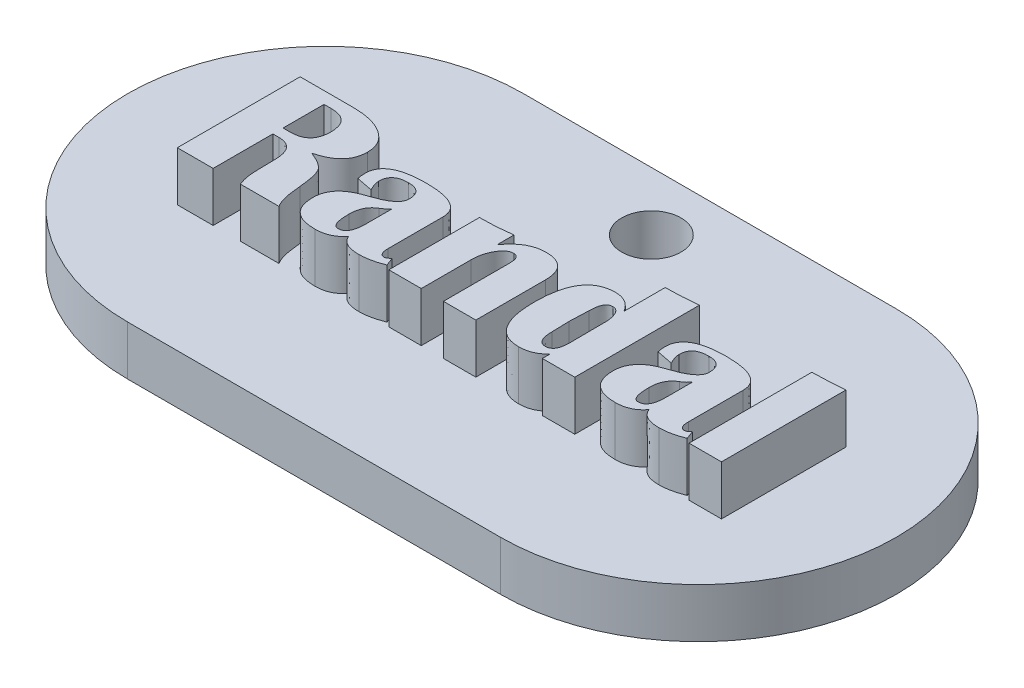
from build123d import *

# Parameters (mm, degrees)
BOSS_EXTRUDE1_DEPTH = 2.5
BOSS_EXTRUDE2_DEPTH = 2.5
SKETCH3_R           = 1.5
CUT_EXTRUDE1_DEPTH  = 5


with BuildPart() as part:
    # Sketch1 → Boss-Extrude1 (new body)
    with BuildSketch(Plane(origin=(0, 0, 0), x_dir=(1, 0, 0), z_dir=(0, 1, 0))):
        with BuildLine():
            Line((-9.422676429, 10), (9.422676429, 10))
            ThreePointArc((9.422676429, 10), (19.422676429, 0), (9.422676429, -10))
            Line((9.422676429, -10), (-9.422676429, -10))
            ThreePointArc((-9.422676429, -10), (-19.422676429, 0), (-9.422676429, 10))
        make_face()
    extrude(amount=BOSS_EXTRUDE1_DEPTH)

    # Sketch2 → Boss-Extrude2 (add)
    # profile 1 of 6: a face of its own
    with BuildSketch(Plane(origin=(0, 2.5, 0), x_dir=(1, 0, 0), z_dir=(0, 1, 0))):
        with BuildLine():
            Line((-13.300121133, -3.615227087), (-13.300121133, 2.59214596))
            Line((-13.300121133, 2.59214596), (-10.620766751, 2.59214596))
            add(Edge.make_bspline(
                [(-10.620766751, 2.59214596), (-10.534960365, 2.590926297), (-10.367589266, 2.588547264), (-10.122863574, 2.567894975), (-9.891520182, 2.534809914), (-9.672859265, 2.48808363), (-9.468362292, 2.425539623), (-9.27553326, 2.352419864), (-9.097683405, 2.262608118), (-8.932756774, 2.162392055), (-8.784834423, 2.049347534), (-8.654609226, 1.927382847), (-8.545338889, 1.794302207), (-8.454283855, 1.653447732), (-8.385227787, 1.501551715), (-8.33498572, 1.341534799), (-8.304579322, 1.171675538), (-8.301373014, 1.055246243), (-8.299737289, 0.995848855)],
                knots=[0, 0, 0, 0, 1.306972684, 2.549337699, 3.738257501, 4.865292255, 5.951610133, 6.993268715, 8.002784987, 8.982402698, 9.929155938, 10.833984252, 11.69405977, 12.546072884, 13.381671869, 14.227594668, 15.09579246, 16, 16, 16, 16], degree=3))
            add(Edge.make_bspline(
                [(-8.299737289, 0.995848855), (-8.300739959, 0.950447813), (-8.302712171, 0.861145812), (-8.319188654, 0.73039609), (-8.346022258, 0.605439961), (-8.384003641, 0.487028987), (-8.431019757, 0.37367222), (-8.490601917, 0.267284073), (-8.56098944, 0.167418499), (-8.64178427, 0.073257837), (-8.732568306, -0.015617309), (-8.836283557, -0.095929493), (-8.948746647, -0.172390976), (-9.072445692, -0.241670872), (-9.206452331, -0.305406835), (-9.351652008, -0.361739706), (-9.50732655, -0.412740649), (-9.615687033, -0.441573376), (-9.671071005, -0.456310031)],
                knots=[0, 0, 0, 0, 0.999139035, 1.96526581, 2.895900214, 3.808725844, 4.699118832, 5.592961802, 6.486968724, 7.384357296, 8.321061346, 9.278195975, 10.26790247, 11.312507066, 12.395774615, 13.532001202, 14.738584651, 16, 16, 16, 16], degree=3))
            add(Edge.make_bspline(
                [(-9.671071005, -0.456310031), (-9.616069374, -0.477316291), (-9.509993534, -0.517828848), (-9.360735182, -0.584978873), (-9.22730079, -0.654252333), (-9.106934527, -0.72189136), (-9.004042977, -0.795209803), (-8.914004739, -0.86715284), (-8.839933494, -0.941923355), (-8.779512374, -1.021572393), (-8.729796314, -1.111693637), (-8.685490826, -1.216484023), (-8.645845535, -1.339251995), (-8.609600689, -1.480074772), (-8.577828078, -1.638884969), (-8.54984592, -1.815521055), (-8.525522639, -2.010054758), (-8.513479475, -2.14595976), (-8.507188559, -2.216951648)],
                knots=[0, 0, 0, 0, 1.225899306, 2.364262592, 3.405591656, 4.356650469, 5.236059752, 6.033446588, 6.754175432, 7.421814961, 8.10843594, 8.891773243, 9.787730148, 10.792436378, 11.918404585, 13.158979899, 14.515953223, 16, 16, 16, 16], degree=3))
            add(Edge.make_bspline(
                [(-8.507188559, -2.216951648), (-8.499628511, -2.301418927), (-8.485166922, -2.462996091), (-8.456174044, -2.694154696), (-8.41925879, -2.902415081), (-8.380545694, -3.089186986), (-8.332635965, -3.252565737), (-8.282887195, -3.394860313), (-8.225802236, -3.515307342), (-8.178881039, -3.583396522), (-8.156946156, -3.615227087)],
                knots=[0, 0, 0, 0, 1.397178565, 2.672658018, 3.83661044, 4.881375567, 5.813226105, 6.639317975, 7.363903672, 8, 8, 8, 8], degree=3))
            Line((-8.156946156, -3.615227087), (-10.111568181, -3.615227087))
            add(Edge.make_bspline(
                [(-10.111568181, -3.615227087), (-10.14098398, -3.538616179), (-10.202114021, -3.379408266), (-10.256750447, -3.117501799), (-10.292400216, -2.830433405), (-10.296620116, -2.629735262), (-10.298813158, -2.525434379)],
                knots=[0, 0, 0, 0, 0.883751818, 1.83655679, 2.875679508, 4, 4, 4, 4], degree=3))
            Line((-10.298813158, -2.525434379), (-10.306895675, -2.152291512))
            Line((-10.306895675, -2.152291512), (-10.316325278, -1.683505527))
            add(Edge.make_bspline(
                [(-10.316325278, -1.683505527), (-10.317325906, -1.639494456), (-10.319257996, -1.554514423), (-10.327702855, -1.431037489), (-10.346224685, -1.316593856), (-10.367512744, -1.209691912), (-10.399711764, -1.112515815), (-10.435014503, -1.02227846), (-10.48041685, -0.941895471), (-10.52940234, -0.867579143), (-10.588542979, -0.804796888), (-10.651784902, -0.747795624), (-10.724675302, -0.702697644), (-10.802225324, -0.663223449), (-10.887268794, -0.632922867), (-10.978949403, -0.614247588), (-11.076951409, -0.599286105), (-11.144717996, -0.598276731), (-11.179807509, -0.597754078)],
                knots=[0, 0, 0, 0, 1.332825818, 2.573524801, 3.742441731, 4.840942882, 5.868429177, 6.837798795, 7.768658095, 8.658513287, 9.524477505, 10.372326923, 11.228310675, 12.10982003, 13.004128928, 13.950736595, 14.938892181, 16, 16, 16, 16], degree=3))
            Line((-11.179807509, -0.597754078), (-11.489637327, -0.597754078))
            Line((-11.489637327, -0.597754078), (-11.489637327, -3.615227087))
            Line((-11.489637327, -3.615227087), (-13.300121133, -3.615227087))
        make_face()
        with BuildLine():
            Line((-11.489637327, -0.080472991), (-11.125924063, -0.080472991))
            add(Edge.make_bspline(
                [(-11.125924063, -0.080472991), (-11.085033055, -0.079725447), (-11.005307858, -0.078267962), (-10.889956311, -0.066216034), (-10.78224427, -0.045981745), (-10.682470877, -0.017931419), (-10.590497115, 0.018020113), (-10.507119171, 0.063290464), (-10.431261586, 0.116177463), (-10.362080546, 0.176371118), (-10.302452063, 0.246200784), (-10.250792026, 0.323501302), (-10.208077329, 0.409384629), (-10.170889535, 0.502274099), (-10.145035894, 0.604373236), (-10.124482444, 0.71362389), (-10.112393209, 0.831236076), (-10.110959912, 0.91230223), (-10.110221095, 0.954089184)],
                knots=[0, 0, 0, 0, 1.179820008, 2.300295035, 3.342267738, 4.339024696, 5.287087512, 6.18577983, 7.070063511, 7.951399096, 8.824215462, 9.711910452, 10.627538894, 11.587657008, 12.593469482, 13.660914265, 14.794277731, 16, 16, 16, 16], degree=3))
            add(Edge.make_bspline(
                [(-10.110221095, 0.954089184), (-10.110959912, 0.995876138), (-10.112393209, 1.076942292), (-10.124482444, 1.194554478), (-10.145035894, 1.303805132), (-10.170889535, 1.405904269), (-10.208077329, 1.498793739), (-10.250792026, 1.584677066), (-10.302452063, 1.661977584), (-10.362080546, 1.73180725), (-10.431261586, 1.792000905), (-10.507119171, 1.844887904), (-10.590497115, 1.890158255), (-10.682470877, 1.926109786), (-10.78224427, 1.954160113), (-10.889956311, 1.974394402), (-11.005307858, 1.986446329), (-11.085033055, 1.987903815), (-11.125924063, 1.988651358)],
                knots=[0, 0, 0, 0, 1.205722269, 2.339085735, 3.406530518, 4.412342992, 5.372461106, 6.288089548, 7.175784538, 8.048600904, 8.929936489, 9.81422017, 10.712912488, 11.660975304, 12.657732262, 13.699704965, 14.820179992, 16, 16, 16, 16], degree=3))
            Line((-11.125924063, 1.988651358), (-11.489637327, 1.988651358))
            Line((-11.489637327, 1.988651358), (-11.489637327, -0.080472991))
        make_face(mode=Mode.SUBTRACT)
    # profile 2 of 6: a face of its own
    with BuildSketch(Plane(origin=(0, 2.5, 0), x_dir=(1, 0, 0), z_dir=(0, 1, 0))):
        with BuildLine():
            add(Edge.make_bspline(
                [(-2.866938787, -3.450882575), (-2.966431564, -3.48918748), (-3.160928015, -3.564068977), (-3.458424622, -3.641764447), (-3.751639019, -3.691553029), (-3.946661824, -3.698172536), (-4.042945009, -3.701440601)],
                knots=[0, 0, 0, 0, 1.056879314, 2.066072368, 3.0452157, 4, 4, 4, 4], degree=3))
            add(Edge.make_bspline(
                [(-4.042945009, -3.701440601), (-4.110391437, -3.700180587), (-4.238644044, -3.69778461), (-4.421260666, -3.672020586), (-4.583537281, -3.629829087), (-4.726504699, -3.570318771), (-4.849415149, -3.493677973), (-4.951202774, -3.398245333), (-5.034876576, -3.286777766), (-5.07030469, -3.200833225), (-5.088283873, -3.157217791)],
                knots=[0, 0, 0, 0, 1.282268188, 2.438294246, 3.499107553, 4.463668342, 5.373621945, 6.237846899, 7.105736429, 8, 8, 8, 8], degree=3))
            add(Edge.make_bspline(
                [(-5.088283873, -3.157217791), (-5.12316245, -3.200806031), (-5.191820312, -3.286608707), (-5.311948341, -3.398105032), (-5.443777225, -3.491327496), (-5.585926538, -3.568979762), (-5.74007482, -3.628310293), (-5.904928757, -3.671295905), (-6.081152022, -3.697391372), (-6.202233343, -3.700068511), (-6.264290094, -3.701440601)],
                knots=[0, 0, 0, 0, 0.993684051, 1.956049413, 2.908452201, 3.864343655, 4.834559242, 5.843680893, 6.89484061, 8, 8, 8, 8], degree=3))
            add(Edge.make_bspline(
                [(-6.264290094, -3.701440601), (-6.322261692, -3.700523204), (-6.434403287, -3.698748569), (-6.596805449, -3.681813467), (-6.748336262, -3.657083782), (-6.889058086, -3.620699292), (-7.018865854, -3.574009905), (-7.137209822, -3.515625848), (-7.243999188, -3.447030658), (-7.339572721, -3.367582544), (-7.425020867, -3.278798985), (-7.498406376, -3.178178894), (-7.558731644, -3.06611959), (-7.610249285, -2.945105481), (-7.649526266, -2.813157328), (-7.675174223, -2.670785647), (-7.693918693, -2.518292709), (-7.695452087, -2.412791115), (-7.696242688, -2.358395695)],
                knots=[0, 0, 0, 0, 1.235120868, 2.38924627, 3.476397774, 4.504669834, 5.482542067, 6.411274067, 7.311157636, 8.181131531, 9.05431034, 9.930995801, 10.82613438, 11.761058323, 12.729945035, 13.752859149, 14.841399769, 16, 16, 16, 16], degree=3))
            add(Edge.make_bspline(
                [(-7.696242688, -2.358395695), (-7.695130766, -2.316593976), (-7.692947642, -2.234521304), (-7.677987047, -2.113618304), (-7.652439077, -1.997201425), (-7.615895651, -1.885489443), (-7.570021793, -1.778561821), (-7.514241554, -1.676544528), (-7.44829897, -1.579221728), (-7.370503637, -1.487776457), (-7.284437849, -1.399458804), (-7.186386489, -1.317362375), (-7.078868467, -1.239389613), (-6.961274535, -1.166633486), (-6.83371805, -1.099142346), (-6.695990804, -1.036053235), (-6.548284407, -0.976524628), (-6.445006138, -0.942481431), (-6.39226328, -0.925096016)],
                knots=[0, 0, 0, 0, 0.958959357, 1.882801888, 2.790126755, 3.689285561, 4.575305972, 5.455859481, 6.353068664, 7.26715253, 8.206883801, 9.179032903, 10.19699077, 11.25186367, 12.348710126, 13.505688165, 14.726187642, 16, 16, 16, 16], degree=3))
            add(Edge.make_bspline(
                [(-6.39226328, -0.925096016), (-6.298447183, -0.893460213), (-6.121084357, -0.833651548), (-5.877142616, -0.731960669), (-5.669471605, -0.626248561), (-5.499732562, -0.513836161), (-5.366130506, -0.396178013), (-5.267822982, -0.274274512), (-5.207653159, -0.143005026), (-5.199872452, -0.052288158), (-5.196050766, -0.007730338)],
                knots=[0, 0, 0, 0, 1.488797015, 2.814626232, 3.971579162, 4.988716818, 5.868735512, 6.638787967, 7.331407237, 8, 8, 8, 8], degree=3))
            add(Edge.make_bspline(
                [(-5.196050766, -0.007730338), (-5.19775117, 0.047237267), (-5.200966254, 0.151168763), (-5.234569904, 0.296898874), (-5.291617942, 0.421036023), (-5.371272944, 0.524946126), (-5.476919711, 0.602577761), (-5.604161984, 0.656761844), (-5.752450589, 0.690631538), (-5.859067575, 0.693783445), (-5.915394778, 0.69544864)],
                knots=[0, 0, 0, 0, 1.142637826, 2.160473586, 3.088677903, 3.967383079, 4.855235242, 5.784239067, 6.829383386, 8, 8, 8, 8], degree=3))
            add(Edge.make_bspline(
                [(-5.915394778, 0.69544864), (-5.9806657, 0.693708095), (-6.103145399, 0.690441993), (-6.274542971, 0.658046783), (-6.420578751, 0.605643163), (-6.541560515, 0.529674836), (-6.636037782, 0.43048713), (-6.701175832, 0.307868241), (-6.741264234, 0.164919148), (-6.74559889, 0.062607331), (-6.747894028, 0.008434696)],
                knots=[0, 0, 0, 0, 1.268973575, 2.381205858, 3.379395825, 4.271425461, 5.136821322, 6.012741233, 6.947775072, 8, 8, 8, 8], degree=3))
            add(Edge.make_bspline(
                [(-6.747894028, 0.008434696), (-6.744966427, -0.030351878), (-6.738581766, -0.114939624), (-6.702136145, -0.249369939), (-6.643053619, -0.400124948), (-6.59201419, -0.504277666), (-6.564690309, -0.560035665)],
                knots=[0, 0, 0, 0, 0.774171244, 1.688352274, 2.762462888, 4, 4, 4, 4], degree=3))
            Line((-6.564690309, -0.560035665), (-7.387759956, -0.401079498))
            add(Edge.make_bspline(
                [(-7.387759956, -0.401079498), (-7.402463452, -0.330836352), (-7.430745443, -0.195724545), (-7.435378002, -0.057789454), (-7.437602144, 0.008434696)],
                knots=[0, 0, 0, 0, 1.039778055, 2, 2, 2, 2], degree=3))
            add(Edge.make_bspline(
                [(-7.437602144, 0.008434696), (-7.436012011, 0.053877803), (-7.432920593, 0.142224941), (-7.410032969, 0.270244607), (-7.370288931, 0.388764237), (-7.316131721, 0.499339453), (-7.245458946, 0.601180031), (-7.158305715, 0.693285075), (-7.055397918, 0.775418153), (-6.939631416, 0.852000455), (-6.805733108, 0.915811989), (-6.657368131, 0.972002009), (-6.493613956, 1.020829851), (-6.314163368, 1.058762575), (-6.119572867, 1.090234001), (-5.909450668, 1.110599868), (-5.683892728, 1.124834397), (-5.528356896, 1.125943095), (-5.447955879, 1.126516213)],
                knots=[0, 0, 0, 0, 0.851624305, 1.655665189, 2.427562795, 3.187947522, 3.956118909, 4.74211419, 5.555833429, 6.419641229, 7.338145349, 8.329219093, 9.391807277, 10.537582445, 11.765005819, 13.084959286, 14.493130256, 16, 16, 16, 16], degree=3))
            add(Edge.make_bspline(
                [(-5.447955879, 1.126516213), (-5.371610098, 1.125739147), (-5.223755392, 1.124234246), (-5.009236133, 1.112735712), (-4.809852042, 1.090408227), (-4.624609139, 1.063658987), (-4.454911542, 1.025087824), (-4.298911562, 0.981921953), (-4.158438804, 0.927734032), (-4.0321889, 0.866159183), (-3.920851886, 0.795413784), (-3.822422582, 0.717988054), (-3.741435733, 0.629334897), (-3.674028461, 0.533560942), (-3.621042619, 0.429893801), (-3.585024071, 0.316983392), (-3.560849494, 0.196713413), (-3.55896115, 0.113182849), (-3.55799399, 0.07040066)],
                knots=[0, 0, 0, 0, 1.50926466, 2.922910493, 4.244308801, 5.474613126, 6.620353895, 7.682365775, 8.671464678, 9.592456737, 10.454360259, 11.275054007, 12.060273444, 12.818746299, 13.584919584, 14.351247116, 15.155551521, 16, 16, 16, 16], degree=3))
            Line((-3.55799399, 0.07040066), (-3.55799399, -2.704596839))
            add(Edge.make_bspline(
                [(-3.55799399, -2.704596839), (-3.557455894, -2.74192292), (-3.556440424, -2.81236293), (-3.542895433, -2.91029534), (-3.522578979, -2.994372051), (-3.491169641, -3.062377234), (-3.453474563, -3.118255482), (-3.40349262, -3.157094332), (-3.34417698, -3.179363986), (-3.302235558, -3.182522318), (-3.28049424, -3.184159514)],
                knots=[0, 0, 0, 0, 1.438880701, 2.715387445, 3.807936607, 4.761419332, 5.593180532, 6.383303817, 7.161947702, 8, 8, 8, 8], degree=3))
            add(Edge.make_bspline(
                [(-3.28049424, -3.184159514), (-3.264058523, -3.18187803), (-3.226176858, -3.176619578), (-3.1682678, -3.143856689), (-3.098621839, -3.098246146), (-3.05187622, -3.057358402), (-3.025894955, -3.03463295)],
                knots=[0, 0, 0, 0, 0.659262562, 1.519493412, 2.621331725, 4, 4, 4, 4], degree=3))
            Line((-3.025894955, -3.03463295), (-2.866938787, -3.450882575))
        make_face()
        with BuildLine():
            add(Edge.make_bspline(
                [(-5.196050766, -0.868518397), (-5.248674911, -0.925867584), (-5.353847129, -1.040483056), (-5.484870251, -1.124330861), (-5.550334427, -1.166224439)],
                knots=[0, 0, 0, 0, 1.000723297, 2, 2, 2, 2], degree=3))
            add(Edge.make_bspline(
                [(-5.550334427, -1.166224439), (-5.590619754, -1.192570062), (-5.67005709, -1.244520146), (-5.774895158, -1.339975347), (-5.862996114, -1.448743525), (-5.935781153, -1.570512169), (-5.990281819, -1.705724639), (-6.029172904, -1.853283871), (-6.054068944, -2.013152), (-6.05678153, -2.12435467), (-6.058185911, -2.181927407)],
                knots=[0, 0, 0, 0, 0.967677045, 1.908131107, 2.839684773, 3.775830093, 4.752580097, 5.763193974, 6.841942867, 8, 8, 8, 8], degree=3))
            add(Edge.make_bspline(
                [(-6.058185911, -2.181927407), (-6.057230128, -2.253342917), (-6.055441931, -2.386955919), (-6.040589975, -2.573649772), (-6.012231551, -2.73172545), (-5.977131624, -2.863021817), (-5.927171979, -2.965217031), (-5.867564487, -3.0414579), (-5.791926936, -3.089426088), (-5.735948925, -3.095104919), (-5.707943508, -3.097945999)],
                knots=[0, 0, 0, 0, 1.606661438, 3.005941722, 4.206714796, 5.21687408, 6.052624467, 6.748462188, 7.373864194, 8, 8, 8, 8], degree=3))
            add(Edge.make_bspline(
                [(-5.707943508, -3.097945999), (-5.667508915, -3.095328124), (-5.589476978, -3.090276067), (-5.481115677, -3.044130147), (-5.388683484, -2.970374536), (-5.317587597, -2.864290489), (-5.26080859, -2.732986055), (-5.224009308, -2.572416062), (-5.199730434, -2.384738567), (-5.197330477, -2.249825093), (-5.196050766, -2.177886149)],
                knots=[0, 0, 0, 0, 0.819770896, 1.582019392, 2.355801278, 3.195313958, 4.153195118, 5.255097872, 6.536355541, 8, 8, 8, 8], degree=3))
            Line((-5.196050766, -2.177886149), (-5.196050766, -0.868518397))
        make_face(mode=Mode.SUBTRACT)
    # profile 3 of 6: a face of its own
    with BuildSketch(Plane(origin=(0, 2.5, 0), x_dir=(1, 0, 0), z_dir=(0, 1, 0))):
        with BuildLine():
            Line((1.787243912, -3.615227087), (0.149187136, -3.615227087))
            Line((0.149187136, -3.615227087), (0.149187136, -0.25963545))
            add(Edge.make_bspline(
                [(0.149187136, -0.25963545), (0.14819771, -0.218723212), (0.146341883, -0.141985699), (0.131761177, -0.034839232), (0.108434275, 0.056726426), (0.074246206, 0.132953662), (0.026716724, 0.190872247), (-0.028250255, 0.235486006), (-0.096336301, 0.260322866), (-0.144735369, 0.262986602), (-0.170072285, 0.264381068)],
                knots=[0, 0, 0, 0, 1.419672355, 2.66282487, 3.744098251, 4.692270244, 5.534477553, 6.323214835, 7.122202843, 8, 8, 8, 8], degree=3))
            add(Edge.make_bspline(
                [(-0.170072285, 0.264381068), (-0.196674124, 0.262998916), (-0.249645367, 0.260246689), (-0.328019611, 0.240502045), (-0.403336146, 0.207998583), (-0.476022671, 0.162622469), (-0.54461652, 0.103832606), (-0.611093997, 0.032666891), (-0.675465808, -0.050549818), (-0.7564645, -0.17971327), (-0.842506766, -0.3591411), (-0.919039895, -0.593450415), (-0.963514916, -0.847076269), (-0.968849884, -1.022360183), (-0.971588553, -1.112340993)],
                knots=[0, 0, 0, 0, 0.55096084, 1.097107635, 1.664023695, 2.244969598, 2.86568823, 3.530521354, 4.260116113, 5.042286902, 6.686134913, 8.369279496, 10.136194235, 12, 12, 12, 12], degree=3))
            Line((-0.971588553, -1.112340993), (-0.971588553, -3.615227087))
            Line((-0.971588553, -3.615227087), (-2.60964533, -3.615227087))
            Line((-2.60964533, -3.615227087), (-2.60964533, 0.963518787))
            add(Edge.make_bspline(
                [(-2.60964533, 0.963518787), (-2.46996781, 0.964686188), (-2.192688432, 0.96700364), (-1.779771805, 0.98945725), (-1.373082069, 1.025032337), (-1.104839653, 1.060434744), (-0.971588553, 1.078021111)],
                knots=[0, 0, 0, 0, 1.019838513, 2.024521838, 3.01866886, 4, 4, 4, 4], degree=3))
            Line((-0.971588553, 1.078021111), (-0.971588553, 0.219927224))
            add(Edge.make_bspline(
                [(-0.971588553, 0.219927224), (-0.918343646, 0.292137854), (-0.815100218, 0.43215637), (-0.639078671, 0.615746803), (-0.457167836, 0.774099076), (-0.265145629, 0.903333884), (-0.063229519, 1.002594985), (0.146499284, 1.074942234), (0.366150428, 1.117587232), (0.515411953, 1.123513715), (0.591031398, 1.126516213)],
                knots=[0, 0, 0, 0, 1.143084199, 2.216473584, 3.235708746, 4.214036931, 5.159017111, 6.097049134, 7.035919746, 8, 8, 8, 8], degree=3))
            add(Edge.make_bspline(
                [(0.591031398, 1.126516213), (0.639550745, 1.125301554), (0.733188548, 1.122957377), (0.869398741, 1.110059289), (0.995979757, 1.085655527), (1.113513633, 1.05259134), (1.221261187, 1.008819952), (1.320082398, 0.956549419), (1.409620716, 0.894124577), (1.490327676, 0.822255383), (1.559844886, 0.739461633), (1.621877333, 0.648296964), (1.671863338, 0.546586927), (1.71636077, 0.436833364), (1.747772563, 0.316266097), (1.770024965, 0.186440385), (1.785879437, 0.047436136), (1.786780016, -0.048544607), (1.787243912, -0.097985111)],
                knots=[0, 0, 0, 0, 1.18608447, 2.289032083, 3.339401178, 4.332842404, 5.268273941, 6.17659521, 7.059499146, 7.929900425, 8.809592672, 9.695356774, 10.61808369, 11.573894616, 12.585536979, 13.655503672, 14.792329834, 16, 16, 16, 16], degree=3))
            Line((1.787243912, -0.097985111), (1.787243912, -3.615227087))
        make_face()
    # profile 4 of 6: a face of its own
    with BuildSketch(Plane(origin=(0, 2.5, 0), x_dir=(1, 0, 0), z_dir=(0, 1, 0))):
        with BuildLine():
            Line((6.787627755, 2.687789078), (6.787627755, -3.615227087))
            Line((6.787627755, -3.615227087), (5.149570979, -3.615227087))
            Line((5.149570979, -3.615227087), (5.149570979, -3.22053084))
            add(Edge.make_bspline(
                [(5.149570979, -3.22053084), (5.114154566, -3.259251843), (5.044229378, -3.335701519), (4.923502847, -3.432061018), (4.797038532, -3.517254231), (4.659741439, -3.584201105), (4.514431011, -3.637261083), (4.36002033, -3.675165592), (4.196418636, -3.696271931), (4.084533222, -3.699694416), (4.027448204, -3.701440601)],
                knots=[0, 0, 0, 0, 0.997189238, 1.968822863, 2.931091854, 3.894157346, 4.867367995, 5.870507821, 6.913512539, 8, 8, 8, 8], degree=3))
            add(Edge.make_bspline(
                [(4.027448204, -3.701440601), (3.964919312, -3.699736344), (3.842783467, -3.696407468), (3.666085918, -3.667455017), (3.500899708, -3.621661646), (3.347277308, -3.557615401), (3.208170117, -3.470994608), (3.079177851, -3.368956762), (2.962954348, -3.24712729), (2.86103955, -3.105054156), (2.768237673, -2.946984977), (2.691292886, -2.7685654), (2.623132951, -2.573053106), (2.571053815, -2.357991334), (2.526747069, -2.12529428), (2.499222166, -1.873504223), (2.478922878, -1.603461792), (2.477623138, -1.417275208), (2.476952028, -1.321139348)],
                knots=[0, 0, 0, 0, 0.932392274, 1.821214413, 2.663232004, 3.485727835, 4.294605472, 5.100230628, 5.93418763, 6.797132845, 7.703728438, 8.663516709, 9.691056554, 10.789446544, 11.961510558, 13.222932412, 14.566084756, 16, 16, 16, 16], degree=3))
            add(Edge.make_bspline(
                [(2.476952028, -1.321139348), (2.478308879, -1.222327085), (2.480938837, -1.030801129), (2.499286024, -0.75326027), (2.531927685, -0.49476359), (2.575024546, -0.254987902), (2.63331178, -0.034493327), (2.70263562, 0.167445824), (2.786151833, 0.350442882), (2.882974133, 0.514167627), (2.992777448, 0.658540549), (3.115392411, 0.783806294), (3.249983677, 0.891839435), (3.400617739, 0.976292007), (3.561748386, 1.044420183), (3.735897828, 1.093090267), (3.923234586, 1.121438276), (4.052494007, 1.124790264), (4.119050063, 1.126516213)],
                knots=[0, 0, 0, 0, 1.41862167, 2.749687786, 3.990673848, 5.157724951, 6.244472151, 7.261833063, 8.219518982, 9.1272107, 9.987224015, 10.816911206, 11.638469072, 12.455665011, 13.287778011, 14.14495974, 15.044834311, 16, 16, 16, 16], degree=3))
            add(Edge.make_bspline(
                [(4.119050063, 1.126516213), (4.171704009, 1.124741412), (4.275107077, 1.121256015), (4.426358228, 1.092622906), (4.568482711, 1.043075675), (4.703743201, 0.977514479), (4.828379677, 0.888923061), (4.946587988, 0.78376725), (5.054348837, 0.657283733), (5.117280704, 0.563208828), (5.149570979, 0.514939094)],
                knots=[0, 0, 0, 0, 1.00554, 1.974703311, 2.926974345, 3.874635558, 4.836098201, 5.838522626, 6.890948257, 8, 8, 8, 8], degree=3))
            Line((5.149570979, 0.514939094), (5.149570979, 2.59214596))
            add(Edge.make_bspline(
                [(5.149570979, 2.59214596), (5.276222685, 2.593006628), (5.53639757, 2.59477466), (5.936084956, 2.61570983), (6.355694257, 2.644314537), (6.641312625, 2.673062313), (6.787627755, 2.687789078)],
                knots=[0, 0, 0, 0, 0.925741002, 1.901707974, 2.925097596, 4, 4, 4, 4], degree=3))
        make_face()
        with BuildLine():
            add(Edge.make_bspline(
                [(4.659231615, 0.436808097), (4.625980534, 0.434890828), (4.561562736, 0.431176476), (4.473303706, 0.389917352), (4.39728679, 0.32760599), (4.339475088, 0.236537216), (4.294987552, 0.123488497), (4.261178913, -0.01321748), (4.24408983, -0.17433724), (4.241610707, -0.289685907), (4.240287818, -0.35123731)],
                knots=[0, 0, 0, 0, 0.795622095, 1.541370116, 2.301723756, 3.13575848, 4.105980722, 5.220975086, 6.517079688, 8, 8, 8, 8], degree=3))
            Line((4.240287818, -0.35123731), (4.201222319, -1.321139348))
            Line((4.201222319, -1.321139348), (4.226816956, -2.204827872))
            add(Edge.make_bspline(
                [(4.226816956, -2.204827872), (4.227629648, -2.267794158), (4.22915693, -2.386125911), (4.252617425, -2.550795788), (4.28660603, -2.692037459), (4.339762587, -2.807411562), (4.405775501, -2.900077867), (4.489953416, -2.966577498), (4.590503361, -3.005762031), (4.662477016, -3.009699287), (4.6996442, -3.011732485)],
                knots=[0, 0, 0, 0, 1.435849857, 2.698374679, 3.789745713, 4.738976688, 5.581498506, 6.362685285, 7.154490948, 8, 8, 8, 8], degree=3))
            add(Edge.make_bspline(
                [(4.6996442, -3.011732485), (4.735972978, -3.009813296), (4.80590495, -3.006118907), (4.902897202, -2.965662455), (4.984923559, -2.901632924), (5.050871757, -2.811566179), (5.099396632, -2.69705791), (5.135330274, -2.559187102), (5.156030197, -2.396732061), (5.15796801, -2.280326138), (5.159000582, -2.218298734)],
                knots=[0, 0, 0, 0, 0.842588964, 1.621962277, 2.404981474, 3.242288514, 4.193401683, 5.287622157, 6.554697629, 8, 8, 8, 8], degree=3))
            Line((5.159000582, -2.218298734), (5.149570979, -1.10291139))
            Line((5.149570979, -1.10291139), (5.14552972, -0.341807707))
            add(Edge.make_bspline(
                [(5.14552972, -0.341807707), (5.139092537, -0.281008909), (5.12693896, -0.166219121), (5.091858415, -0.007505682), (5.048119976, 0.128150876), (4.99405918, 0.240231916), (4.927226195, 0.328333225), (4.8483909, 0.391505509), (4.757267964, 0.430431002), (4.69238641, 0.434651435), (4.659231615, 0.436808097)],
                knots=[0, 0, 0, 0, 1.452723371, 2.742781328, 3.856939202, 4.835756538, 5.687879974, 6.463239017, 7.214707542, 8, 8, 8, 8], degree=3))
        make_face(mode=Mode.SUBTRACT)
    # profile 5 of 6: a face of its own
    with BuildSketch(Plane(origin=(0, 2.5, 0), x_dir=(1, 0, 0), z_dir=(0, 1, 0))):
        with BuildLine():
            add(Edge.make_bspline(
                [(12.306639772, -3.450882575), (12.207146996, -3.48918748), (12.012650544, -3.564068977), (11.715153937, -3.641764447), (11.42193954, -3.691553029), (11.226916735, -3.698172536), (11.13063355, -3.701440601)],
                knots=[0, 0, 0, 0, 1.056879314, 2.066072368, 3.0452157, 4, 4, 4, 4], degree=3))
            add(Edge.make_bspline(
                [(11.13063355, -3.701440601), (11.063187122, -3.700180587), (10.934934515, -3.69778461), (10.752317893, -3.672020586), (10.590041278, -3.629829087), (10.44707386, -3.570318771), (10.32416341, -3.493677973), (10.222375785, -3.398245333), (10.138701983, -3.286777766), (10.103273869, -3.200833225), (10.085294686, -3.157217791)],
                knots=[0, 0, 0, 0, 1.282268188, 2.438294246, 3.499107553, 4.463668342, 5.373621945, 6.237846899, 7.105736429, 8, 8, 8, 8], degree=3))
            add(Edge.make_bspline(
                [(10.085294686, -3.157217791), (10.050416109, -3.200806031), (9.981758247, -3.286608707), (9.861630218, -3.398105032), (9.729801334, -3.491327496), (9.587652021, -3.568979762), (9.433503739, -3.628310293), (9.268649802, -3.671295905), (9.092426537, -3.697391372), (8.971345216, -3.700068511), (8.909288465, -3.701440601)],
                knots=[0, 0, 0, 0, 0.993684051, 1.956049413, 2.908452201, 3.864343655, 4.834559242, 5.843680893, 6.89484061, 8, 8, 8, 8], degree=3))
            add(Edge.make_bspline(
                [(8.909288465, -3.701440601), (8.851316867, -3.700523204), (8.739175272, -3.698748569), (8.57677311, -3.681813467), (8.425242297, -3.657083782), (8.284520473, -3.620699292), (8.154712705, -3.574009905), (8.036368737, -3.515625848), (7.929579371, -3.447030658), (7.834005838, -3.367582544), (7.748557692, -3.278798985), (7.675172183, -3.178178894), (7.614846915, -3.06611959), (7.563329274, -2.945105481), (7.524052293, -2.813157328), (7.498404336, -2.670785647), (7.479659866, -2.518292709), (7.478126472, -2.412791115), (7.477335872, -2.358395695)],
                knots=[0, 0, 0, 0, 1.235120868, 2.38924627, 3.476397774, 4.504669834, 5.482542067, 6.411274067, 7.311157636, 8.181131531, 9.05431034, 9.930995801, 10.82613438, 11.761058323, 12.729945035, 13.752859149, 14.841399769, 16, 16, 16, 16], degree=3))
            add(Edge.make_bspline(
                [(7.477335872, -2.358395695), (7.478447793, -2.316593976), (7.480630917, -2.234521304), (7.495591512, -2.113618304), (7.521139482, -1.997201425), (7.557682908, -1.885489443), (7.603556766, -1.778561821), (7.659337005, -1.676544528), (7.725279589, -1.579221728), (7.803074922, -1.487776457), (7.88914071, -1.399458804), (7.98719207, -1.317362375), (8.094710092, -1.239389613), (8.212304024, -1.166633486), (8.339860509, -1.099142346), (8.477587755, -1.036053235), (8.625294152, -0.976524628), (8.728572421, -0.942481431), (8.781315279, -0.925096016)],
                knots=[0, 0, 0, 0, 0.958959357, 1.882801888, 2.790126755, 3.689285561, 4.575305972, 5.455859481, 6.353068664, 7.26715253, 8.206883801, 9.179032903, 10.19699077, 11.25186367, 12.348710126, 13.505688165, 14.726187642, 16, 16, 16, 16], degree=3))
            add(Edge.make_bspline(
                [(8.781315279, -0.925096016), (8.875131376, -0.893460213), (9.052494202, -0.833651548), (9.296435943, -0.731960669), (9.504106954, -0.626248561), (9.673845997, -0.513836161), (9.807448053, -0.396178013), (9.905755577, -0.274274512), (9.9659254, -0.143005026), (9.973706107, -0.052288158), (9.977527793, -0.007730338)],
                knots=[0, 0, 0, 0, 1.488797015, 2.814626232, 3.971579162, 4.988716818, 5.868735512, 6.638787967, 7.331407237, 8, 8, 8, 8], degree=3))
            add(Edge.make_bspline(
                [(9.977527793, -0.007730338), (9.975827389, 0.047237267), (9.972612305, 0.151168763), (9.939008655, 0.296898874), (9.881960617, 0.421036023), (9.802305615, 0.524946126), (9.696658848, 0.602577761), (9.569416575, 0.656761844), (9.42112797, 0.690631538), (9.314510984, 0.693783445), (9.258183781, 0.69544864)],
                knots=[0, 0, 0, 0, 1.142637826, 2.160473586, 3.088677903, 3.967383079, 4.855235242, 5.784239067, 6.829383386, 8, 8, 8, 8], degree=3))
            add(Edge.make_bspline(
                [(9.258183781, 0.69544864), (9.192912859, 0.693708095), (9.07043316, 0.690441993), (8.899035588, 0.658046783), (8.752999808, 0.605643163), (8.632018044, 0.529674836), (8.537540777, 0.43048713), (8.472402727, 0.307868241), (8.432314325, 0.164919148), (8.427979669, 0.062607331), (8.425684531, 0.008434696)],
                knots=[0, 0, 0, 0, 1.268973575, 2.381205858, 3.379395825, 4.271425461, 5.136821322, 6.012741233, 6.947775072, 8, 8, 8, 8], degree=3))
            add(Edge.make_bspline(
                [(8.425684531, 0.008434696), (8.428612132, -0.030351878), (8.434996793, -0.114939624), (8.471442414, -0.249369939), (8.53052494, -0.400124948), (8.581564369, -0.504277666), (8.60888825, -0.560035665)],
                knots=[0, 0, 0, 0, 0.774171244, 1.688352274, 2.762462888, 4, 4, 4, 4], degree=3))
            Line((8.60888825, -0.560035665), (7.785818603, -0.401079498))
            add(Edge.make_bspline(
                [(7.785818603, -0.401079498), (7.771115107, -0.330836352), (7.742833116, -0.195724545), (7.738200557, -0.057789454), (7.735976415, 0.008434696)],
                knots=[0, 0, 0, 0, 1.039778055, 2, 2, 2, 2], degree=3))
            add(Edge.make_bspline(
                [(7.735976415, 0.008434696), (7.737566548, 0.053877803), (7.740657966, 0.142224941), (7.76354559, 0.270244607), (7.803289628, 0.388764237), (7.857446838, 0.499339453), (7.928119613, 0.601180031), (8.015272844, 0.693285075), (8.118180641, 0.775418153), (8.233947143, 0.852000455), (8.367845451, 0.915811989), (8.516210428, 0.972002009), (8.679964603, 1.020829851), (8.859415192, 1.058762575), (9.054005692, 1.090234001), (9.264127891, 1.110599868), (9.489685831, 1.124834397), (9.645221663, 1.125943095), (9.72562268, 1.126516213)],
                knots=[0, 0, 0, 0, 0.851624305, 1.655665189, 2.427562795, 3.187947522, 3.956118909, 4.74211419, 5.555833429, 6.419641229, 7.338145349, 8.329219093, 9.391807277, 10.537582445, 11.765005819, 13.084959286, 14.493130256, 16, 16, 16, 16], degree=3))
            add(Edge.make_bspline(
                [(9.72562268, 1.126516213), (9.801968461, 1.125739147), (9.949823167, 1.124234246), (10.164342426, 1.112735712), (10.363726517, 1.090408227), (10.54896942, 1.063658987), (10.718667017, 1.025087824), (10.874666997, 0.981921953), (11.015139756, 0.927734032), (11.141389659, 0.866159183), (11.252726673, 0.795413784), (11.351155977, 0.717988054), (11.432142826, 0.629334897), (11.499550098, 0.533560942), (11.55253594, 0.429893801), (11.588554488, 0.316983392), (11.612729065, 0.196713413), (11.614617409, 0.113182849), (11.615584569, 0.07040066)],
                knots=[0, 0, 0, 0, 1.50926466, 2.922910493, 4.244308801, 5.474613126, 6.620353895, 7.682365775, 8.671464678, 9.592456737, 10.454360259, 11.275054007, 12.060273444, 12.818746299, 13.584919584, 14.351247116, 15.155551521, 16, 16, 16, 16], degree=3))
            Line((11.615584569, 0.07040066), (11.615584569, -2.704596839))
            add(Edge.make_bspline(
                [(11.615584569, -2.704596839), (11.616122665, -2.74192292), (11.617138135, -2.81236293), (11.630683126, -2.91029534), (11.65099958, -2.994372051), (11.682408918, -3.062377234), (11.720103996, -3.118255482), (11.770085939, -3.157094332), (11.829401579, -3.179363986), (11.871343001, -3.182522318), (11.893084319, -3.184159514)],
                knots=[0, 0, 0, 0, 1.438880701, 2.715387445, 3.807936607, 4.761419332, 5.593180532, 6.383303817, 7.161947702, 8, 8, 8, 8], degree=3))
            add(Edge.make_bspline(
                [(11.893084319, -3.184159514), (11.909520036, -3.18187803), (11.947401701, -3.176619578), (12.005310759, -3.143856689), (12.07495672, -3.098246146), (12.121702339, -3.057358402), (12.147683604, -3.03463295)],
                knots=[0, 0, 0, 0, 0.659262562, 1.519493412, 2.621331725, 4, 4, 4, 4], degree=3))
            Line((12.147683604, -3.03463295), (12.306639772, -3.450882575))
        make_face()
        with BuildLine():
            add(Edge.make_bspline(
                [(9.977527793, -0.868518397), (9.924903648, -0.925867584), (9.81973143, -1.040483056), (9.688708308, -1.124330861), (9.623244132, -1.166224439)],
                knots=[0, 0, 0, 0, 1.000723297, 2, 2, 2, 2], degree=3))
            add(Edge.make_bspline(
                [(9.623244132, -1.166224439), (9.582958805, -1.192570062), (9.503521469, -1.244520146), (9.398683401, -1.339975347), (9.310582445, -1.448743525), (9.237797406, -1.570512169), (9.18329674, -1.705724639), (9.144405655, -1.853283871), (9.119509615, -2.013152), (9.116797029, -2.12435467), (9.115392648, -2.181927407)],
                knots=[0, 0, 0, 0, 0.967677045, 1.908131107, 2.839684773, 3.775830093, 4.752580097, 5.763193974, 6.841942867, 8, 8, 8, 8], degree=3))
            add(Edge.make_bspline(
                [(9.115392648, -2.181927407), (9.116348431, -2.253342917), (9.118136628, -2.386955919), (9.132988584, -2.573649772), (9.161347008, -2.73172545), (9.196446935, -2.863021817), (9.246406581, -2.965217031), (9.306014072, -3.0414579), (9.381651623, -3.089426088), (9.437629634, -3.095104919), (9.465635051, -3.097945999)],
                knots=[0, 0, 0, 0, 1.606661438, 3.005941722, 4.206714796, 5.21687408, 6.052624467, 6.748462188, 7.373864194, 8, 8, 8, 8], degree=3))
            add(Edge.make_bspline(
                [(9.465635051, -3.097945999), (9.506069644, -3.095328124), (9.584101581, -3.090276067), (9.692462882, -3.044130147), (9.784895075, -2.970374536), (9.855990962, -2.864290489), (9.912769969, -2.732986055), (9.949569252, -2.572416062), (9.973848125, -2.384738567), (9.976248082, -2.249825093), (9.977527793, -2.177886149)],
                knots=[0, 0, 0, 0, 0.819770896, 1.582019392, 2.355801278, 3.195313958, 4.153195118, 5.255097872, 6.536355541, 8, 8, 8, 8], degree=3))
            Line((9.977527793, -2.177886149), (9.977527793, -0.868518397))
        make_face(mode=Mode.SUBTRACT)
    # profile 6 of 6: a face of its own
    with BuildSketch(Plane(origin=(0, 2.5, 0), x_dir=(1, 0, 0), z_dir=(0, 1, 0))):
        with BuildLine():
            Line((14.201990006, 2.682400733), (14.201990006, -3.615227087))
            Line((14.201990006, -3.615227087), (12.563933229, -3.615227087))
            Line((12.563933229, -3.615227087), (12.563933229, 2.59214596))
            add(Edge.make_bspline(
                [(12.563933229, 2.59214596), (12.682945963, 2.593177532), (12.932763597, 2.595342886), (13.324825316, 2.614622099), (13.751947955, 2.642535821), (14.048020571, 2.668762056), (14.201990006, 2.682400733)],
                knots=[0, 0, 0, 0, 0.870207522, 1.826638015, 2.869766072, 4, 4, 4, 4], degree=3))
        make_face()
    extrude(amount=BOSS_EXTRUDE2_DEPTH)

    # Sketch3 → Cut-Extrude1 (cut)
    with BuildSketch(Plane(origin=(0, 2.5, 0), x_dir=(1, 0, 0), z_dir=(0, 1, 0))):
        with Locations(Location((0, 7.041714459, 0), (0, 0, 270))):
            Circle(SKETCH3_R)
    extrude(amount=-CUT_EXTRUDE1_DEPTH, mode=Mode.SUBTRACT)


solid = part.part
